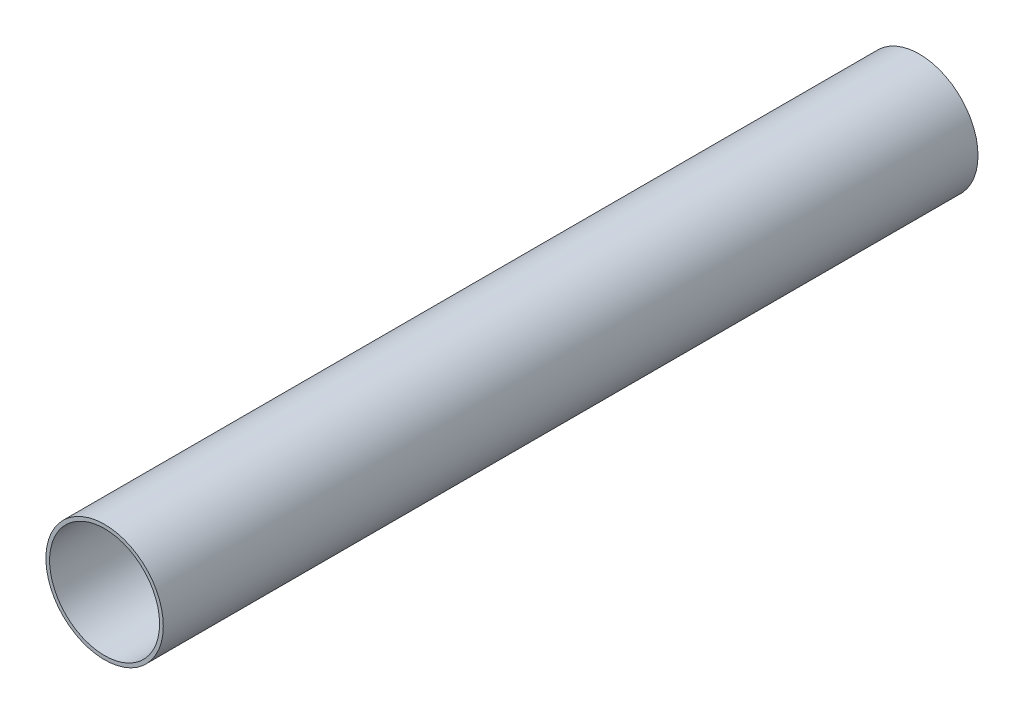
from build123d import *

# Parameters (mm, degrees)
ESQUISSE1_R        = 15.85
BOSS_EXTRU_1_DEPTH = 220
COQUE1_T           = -1


with BuildPart() as part:
    # Esquisse1 → Boss.-Extru.1 (new body)
    with BuildSketch(Plane.XY):
        Circle(ESQUISSE1_R)
    extrude(amount=BOSS_EXTRU_1_DEPTH)

    # Coque1
    coque1_openings = [part.faces().sort_by_distance(p)[0] for p in [
        (0, 0, 220),
        (0, 0, 0),
    ]]
    offset(amount=COQUE1_T, openings=coque1_openings, kind=Kind.INTERSECTION)


solid = part.part
